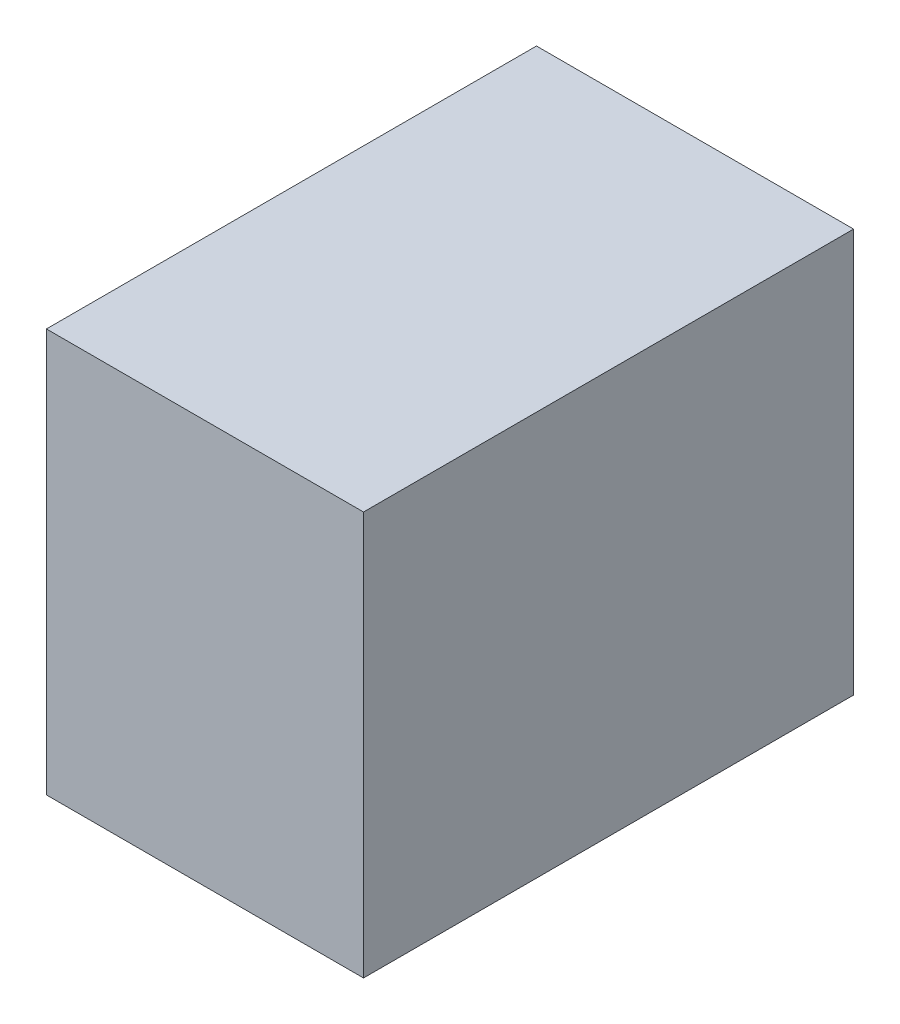
from build123d import *

# Parameters (mm, degrees)
SKETCH1_W           = 55
SKETCH1_H           = 85
BOSS_EXTRUDE1_DEPTH = 70


with BuildPart() as part:
    # Sketch1 → Boss-Extrude1 (new body)
    with BuildSketch(Plane(origin=(0, 0, 0), x_dir=(1, 0, 0), z_dir=(0, 1, 0))):
        Rectangle(SKETCH1_W, SKETCH1_H)
    extrude(amount=BOSS_EXTRUDE1_DEPTH)


solid = part.part
